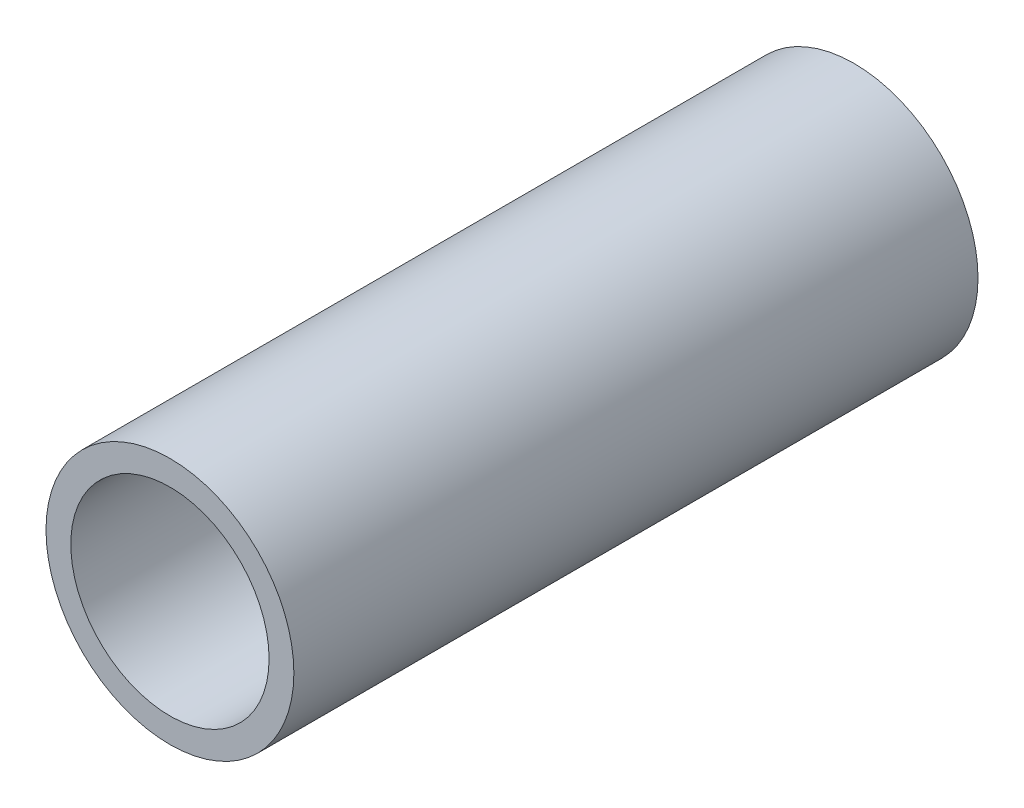
from build123d import *

# Parameters (mm, degrees)
SKETCH1_R      = 1.25
SKETCH1_R_2    = 1
EXTRUDE1_DEPTH = 6.9


with BuildPart() as part:
    # Sketch1 → Extrude1 (new body)
    with BuildSketch(Plane.XY):
        Circle(SKETCH1_R)
        Circle(SKETCH1_R_2, mode=Mode.SUBTRACT)
    extrude(amount=-EXTRUDE1_DEPTH)


solid = part.part
